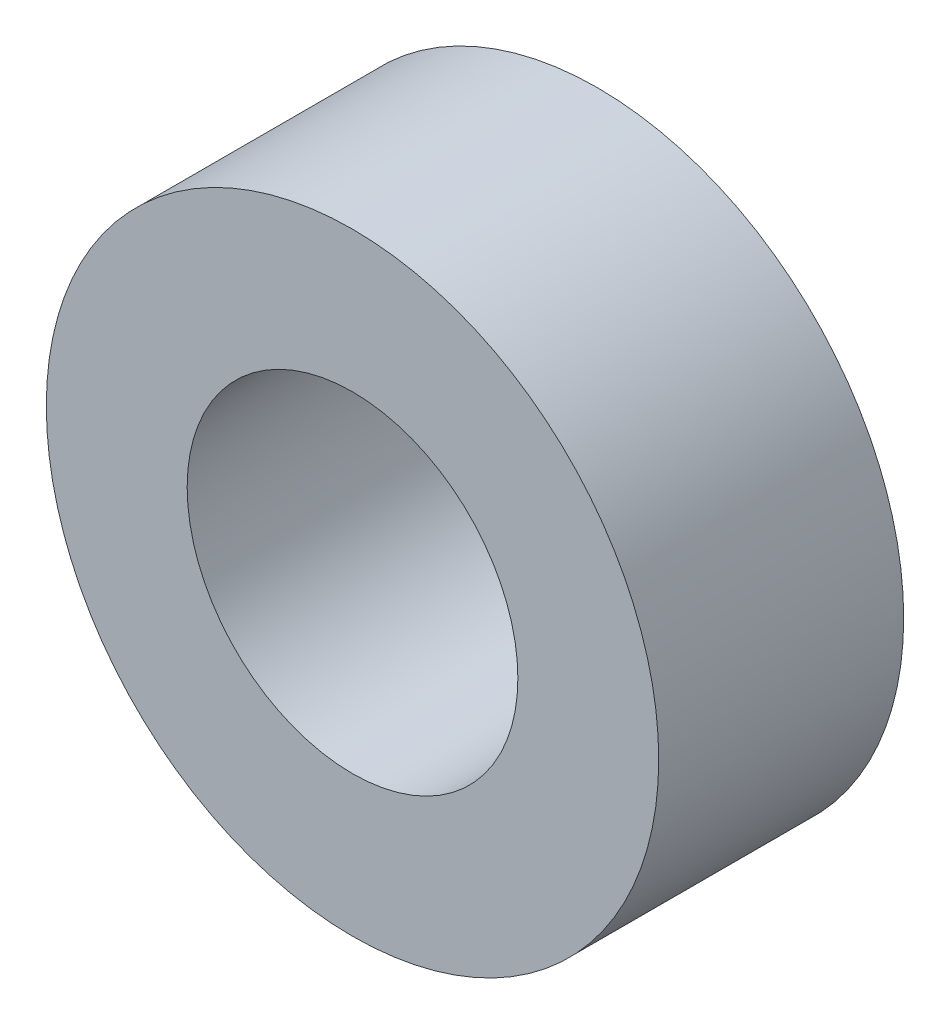
from build123d import *

# Parameters (mm, degrees)
SKETCH_1_R      = 2.5
SKETCH_1_R_2    = 1.35
EXTRUDE_1_DEPTH = 2


with BuildPart() as part:
    # ｽｹｯﾁ1 → ﾎﾞｽ - 押し出し1 (new body)
    with BuildSketch(Plane.XY):
        Circle(SKETCH_1_R)
        Circle(SKETCH_1_R_2, mode=Mode.SUBTRACT)
    extrude(amount=EXTRUDE_1_DEPTH)


solid = part.part
